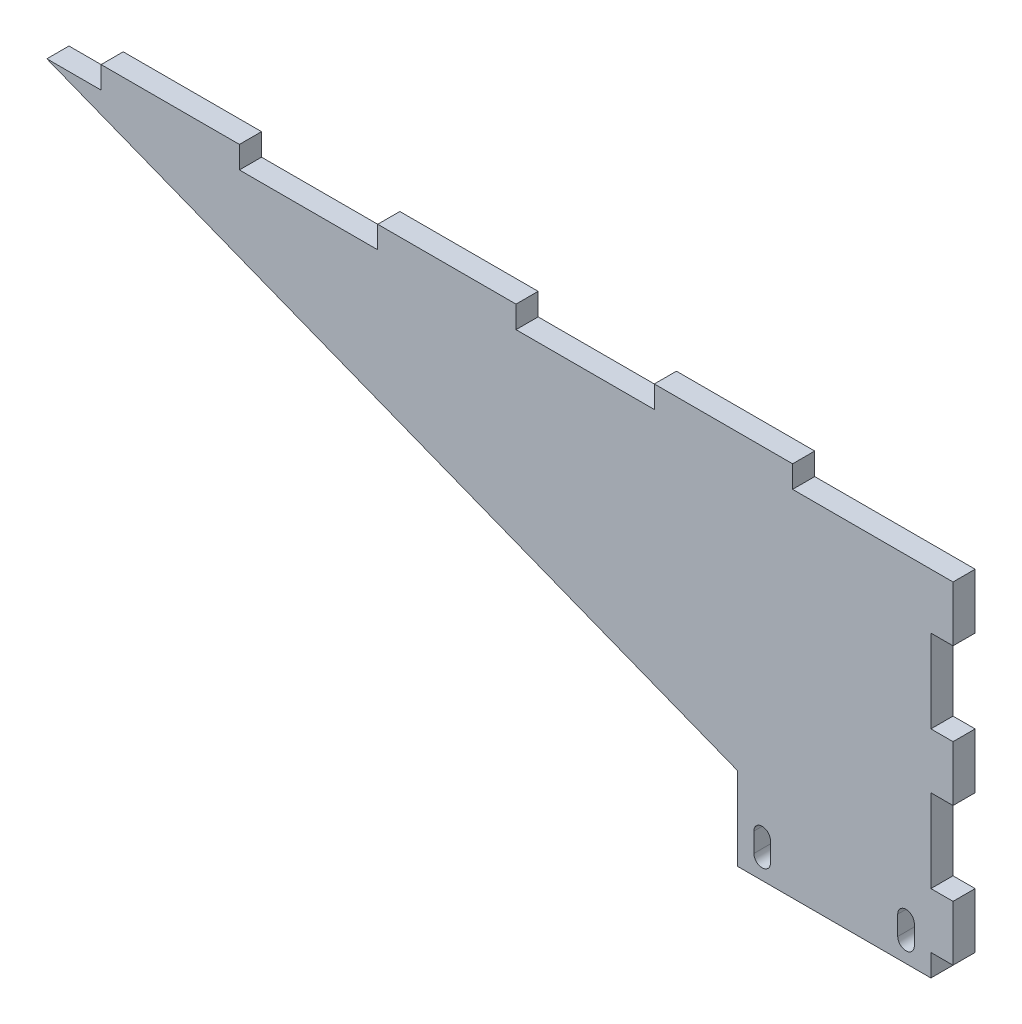
from build123d import *

# Parameters (mm, degrees)
BOSS_EXTRUDE1_DEPTH = 2
CUT_EXTRUDE1_REACH  = 186.662
SKETCH3_W           = 25
SKETCH3_H           = 4
CUT_EXTRUDE2_DEPTH  = 185.661853126
SKETCH4_W           = 4
SKETCH4_H           = 10
BOSS_EXTRUDE2_DEPTH = 4


with BuildPart() as part:
    # Sketch1 → Boss-Extrude1 (new, symmetric)
    with BuildSketch(Plane.XY):
        Polygon((0, 4), (0, 72), (-170, 72), (-35, 19), (-35, 4), align=None)
    extrude(amount=BOSS_EXTRUDE1_DEPTH, both=True)

    # Sketch2 → Cut-Extrude1 (cut, up to next)
    with BuildSketch(Plane.XY.offset(2), mode=Mode.PRIVATE) as cut_extrude1_sk1:
        with BuildLine():
            Line((-3, 11), (-3, 7.5))
            ThreePointArc((-3, 7.5), (-4.5, 6), (-6, 7.5))
            Line((-6, 7.5), (-6, 11))
            ThreePointArc((-6, 11), (-4.5, 12.5), (-3, 11))
        make_face()
    cut_extrude1_tool1 = extrude(cut_extrude1_sk1.sketch, amount=-CUT_EXTRUDE1_REACH, mode=Mode.PRIVATE) & part.part
    # Sketch2 → Cut-Extrude1 (cut, up to next)
    with BuildSketch(Plane.XY.offset(2), mode=Mode.PRIVATE) as cut_extrude1_sk2:
        with BuildLine():
            Line((-32, 11), (-32, 7.5))
            ThreePointArc((-32, 7.5), (-30.5, 6), (-29, 7.5))
            Line((-29, 7.5), (-29, 11))
            ThreePointArc((-29, 11), (-30.5, 12.5), (-32, 11))
        make_face()
    cut_extrude1_tool2 = extrude(cut_extrude1_sk2.sketch, amount=-CUT_EXTRUDE1_REACH, mode=Mode.PRIVATE) & part.part
    add(cut_extrude1_tool1.solids().sort_by_distance((-4.5, 9.25, 2))[0], mode=Mode.SUBTRACT)
    add(cut_extrude1_tool2.solids().sort_by_distance((-30.5, 9.25, 2))[0], mode=Mode.SUBTRACT)

    # Sketch3 → Cut-Extrude2 (cut, through all)
    with BuildSketch(Plane.XY.offset(2)):
        with Locations((-62.5, 70)):
            Rectangle(SKETCH3_W, SKETCH3_H)
        with Locations((-12.5, 70)):
            Rectangle(SKETCH3_W, SKETCH3_H)
        with Locations((-112.5, 70)):
            Rectangle(SKETCH3_W, SKETCH3_H)
        with Locations((-162.5, 70)):
            Rectangle(SKETCH3_W, SKETCH3_H)
        with Locations((-212.5, 70)):
            Rectangle(SKETCH3_W, SKETCH3_H)
        with Locations((-262.5, 70)):
            Rectangle(SKETCH3_W, SKETCH3_H)
        with Locations((-312.5, 70)):
            Rectangle(SKETCH3_W, SKETCH3_H)
        with Locations((-362.5, 70)):
            Rectangle(SKETCH3_W, SKETCH3_H)
        with Locations((-412.5, 70)):
            Rectangle(SKETCH3_W, SKETCH3_H)
        with Locations((-462.5, 70)):
            Rectangle(SKETCH3_W, SKETCH3_H)
    extrude(amount=-CUT_EXTRUDE2_DEPTH, mode=Mode.SUBTRACT)

    # Sketch4 → Boss-Extrude2 (add)
    with BuildSketch(Plane(origin=(0, 0, 0), x_dir=(0, 0, -1), z_dir=(1, 0, 0))):
        with Locations((0, 63)):
            Rectangle(SKETCH4_W, SKETCH4_H)
        with Locations((0, 38)):
            Rectangle(SKETCH4_W, SKETCH4_H)
        with Locations((0, 13)):
            Rectangle(SKETCH4_W, SKETCH4_H)
    extrude(amount=BOSS_EXTRUDE2_DEPTH)


solid = part.part
